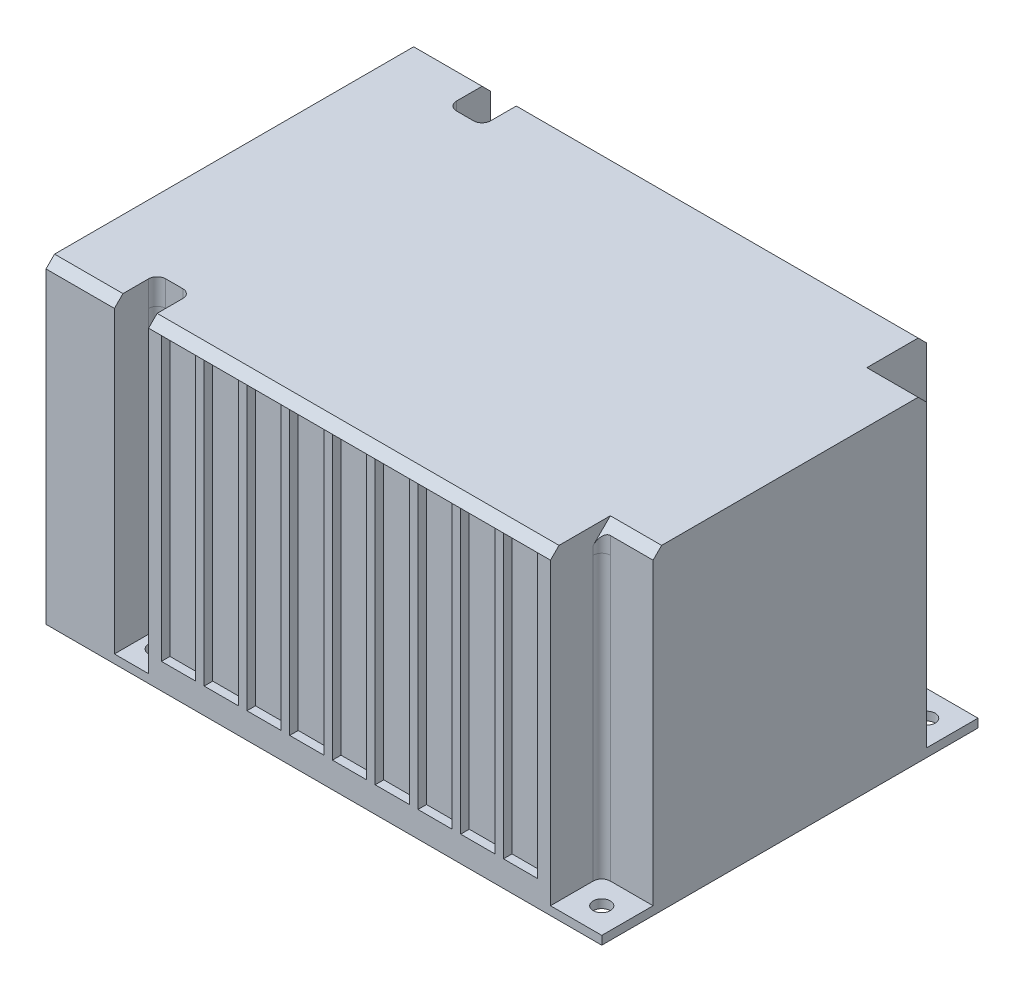
from build123d import *

# Parameters (mm, degrees)
BOSS_EXTRUDE1_DEPTH = 170
SKETCH3_W           = 20
SKETCH3_H           = 25
SKETCH3_R           = 5
SKETCH3_W_2         = 30
SKETCH3_H_2         = 30
BOSS_EXTRUDE2_DEPTH = 5
FILLET1_R           = 5
SKETCH5_R           = 3
CUT_EXTRUDE1_DEPTH  = 3
BOSS_EXTRUDE5_DEPTH = 15
CHAMFER1_SIZE       = 5
FILLET2_R           = 5
SKETCH15_R          = 3
CUT_EXTRUDE2_DEPTH  = 5
SKETCH16_R          = 3
CUT_EXTRUDE3_DEPTH  = 5
SKETCH18_W          = 20
SKETCH18_H          = 165
CUT_EXTRUDE9_DEPTH  = 5
SKETCH21_W          = 20
SKETCH21_H          = 165
CUT_EXTRUDE10_DEPTH = 5


with BuildPart() as part:
    # Sketch1 → Boss-Extrude1 (new body)
    with BuildSketch(Plane(origin=(0, 0, 0), x_dir=(1, 0, 0), z_dir=(0, 1, 0))):
        Polygon((162.5, 80), (162.5, -80), (152.5, -80), (147.5, -80), (132.5, -80), (132.5, -95), (132.5, -100), (132.5, -110), (-102.5, -110), (-102.5, -100), (-102.5, -85), (-112.5, -85), (-122.5, -85), (-122.5, -100), (-122.5, -110), (-162.5, -110), (-162.5, -100), (-162.5, -95), (-132.5, -95), (-132.5, -85), (-132.5, -75), (-93.003639463, -75), (-93.003639463, -100), (122.5, -100), (122.5, -70), (152.5, -70), (152.5, 70), (122.5, 70), (122.5, 100), (-93.003639463, 100), (-93.003639463, 75), (-132.5, 75), (-132.5, 85), (-132.5, 95), (-162.5, 95), (-162.5, 100), (-162.5, 110), (-122.5, 110), (-122.5, 100), (-122.5, 85), (-112.5, 85), (-102.5, 85), (-102.5, 100), (-102.5, 110), (132.5, 110), (132.5, 100), (132.5, 95), (132.5, 80), (147.5, 80), (152.5, 80), align=None)
    extrude(amount=BOSS_EXTRUDE1_DEPTH)

    # Sketch3 → Boss-Extrude2 (add)
    # profile 1 of 4: a face of its own
    with BuildSketch(Plane(origin=(0, 0, 0), x_dir=(1, 0, 0), z_dir=(0, 1, 0))):
        with Locations((-112.5, -97.5)):
            Rectangle(SKETCH3_W, SKETCH3_H)
        with Locations(Location((-112.5, -95, 0), (0, 0, 270))):
            Circle(SKETCH3_R, mode=Mode.SUBTRACT)
    # profile 2 of 4: a face of its own
    with BuildSketch(Plane(origin=(0, 0, 0), x_dir=(1, 0, 0), z_dir=(0, 1, 0))):
        with Locations((147.5, -95)):
            Rectangle(SKETCH3_W_2, SKETCH3_H_2)
        with Locations(Location((147.5, -95, 0), (0, 0, 270))):
            Circle(SKETCH3_R, mode=Mode.SUBTRACT)
    # profile 3 of 4: a face of its own
    with BuildSketch(Plane(origin=(0, 0, 0), x_dir=(1, 0, 0), z_dir=(0, 1, 0))):
        with Locations((-112.5, 97.5)):
            Rectangle(SKETCH3_W, SKETCH3_H)
        with Locations(Location((-112.5, 95, 0), (0, 0, 90))):
            Circle(SKETCH3_R, mode=Mode.SUBTRACT)
    # profile 4 of 4: a face of its own
    with BuildSketch(Plane(origin=(0, 0, 0), x_dir=(1, 0, 0), z_dir=(0, 1, 0))):
        with Locations((147.5, 95)):
            Rectangle(SKETCH3_W_2, SKETCH3_H_2)
        with Locations(Location((147.5, 95, 0), (0, 0, 270))):
            Circle(SKETCH3_R, mode=Mode.SUBTRACT)
    extrude(amount=BOSS_EXTRUDE2_DEPTH)

    # Fillet1
    fillet1_edges = [part.edges().sort_by_distance(p)[0] for p in [
        (-122.5, 87.5, 85),
        (-102.5, 87.5, 85),
        (132.5, 87.5, 80),
        (132.5, 87.5, -80),
        (-102.5, 87.5, -85),
        (-122.5, 87.5, -85),
    ]]
    fillet(fillet1_edges, radius=FILLET1_R)

    # Sketch5 → Cut-Extrude1 (cut)
    with BuildSketch(Plane.ZY.offset(132.5)):
        with Locations((-85, 5)):
            Circle(SKETCH5_R)
        with Locations(Location((85, 5, 0), (0, 0, 180))):
            Circle(SKETCH5_R)
        with Locations((-85, 165)):
            Circle(SKETCH5_R)
        with Locations(Location((85, 165, 0), (0, 0, 180))):
            Circle(SKETCH5_R)
    extrude(amount=-CUT_EXTRUDE1_DEPTH, mode=Mode.SUBTRACT)

    # Sketch10 → Boss-Extrude5 (add)
    with BuildSketch(Plane(origin=(0, 170, 0), x_dir=(1, 0, 0), z_dir=(0, 1, 0))):
        Polygon((-162.5, 95), (-162.5, -95), (-162.5, -100), (-162.5, -110), (-122.5, -110), (-122.5, -100), (-122.5, -85), (-112.5, -85), (-102.5, -85), (-102.5, -100), (-102.5, -110), (132.5, -110), (132.5, -100), (132.5, -95), (132.5, -80), (147.5, -80), (152.5, -80), (162.5, -80), (162.5, 80), (152.5, 80), (147.5, 80), (132.5, 80), (132.5, 95), (132.5, 100), (132.5, 110), (-102.5, 110), (-102.5, 100), (-102.5, 85), (-112.5, 85), (-122.5, 85), (-122.5, 100), (-122.5, 110), (-162.5, 110), (-162.5, 100), align=None)
    extrude(amount=BOSS_EXTRUDE5_DEPTH)

    # Chamfer1
    chamfer1_edges = [part.edges().sort_by_distance(p)[0] for p in [
        (147.5, 185, -80),
        (15, 185, -110),
        (-142.5, 185, -110),
        (-142.5, 185, 110),
        (15, 185, 110),
        (147.5, 185, 80),
    ]]
    chamfer(chamfer1_edges, length=CHAMFER1_SIZE)

    # Fillet2
    fillet2_edges = [part.edges().sort_by_distance(p)[0] for p in [
        (-122.5, 177.5, -85),
        (-102.5, 177.5, -85),
        (132.5, 175, -80),
        (132.5, 175, 80),
        (-102.5, 177.5, 85),
        (-122.5, 177.5, 85),
    ]]
    fillet(fillet2_edges, radius=FILLET2_R)

    # Sketch15 → Cut-Extrude2 (cut)
    with BuildSketch(Plane.XZ):
        with Locations(Location((67.5, -105, 0), (0, 0, 90))):
            Circle(SKETCH15_R)
        with Locations(Location((-32.5, -105, 0), (0, 0, 90))):
            Circle(SKETCH15_R)
        with Locations(Location((157.5, -35, 0), (0, 0, 90))):
            Circle(SKETCH15_R)
        with Locations(Location((157.5, 35, 0), (0, 0, 270))):
            Circle(SKETCH15_R)
        with Locations(Location((67.5, 105, 0), (0, 0, 270))):
            Circle(SKETCH15_R)
        with Locations(Location((-32.5, 105, 0), (0, 0, 270))):
            Circle(SKETCH15_R)
    extrude(amount=-CUT_EXTRUDE2_DEPTH, mode=Mode.SUBTRACT)

    # Sketch16 → Cut-Extrude3 (cut)
    with BuildSketch(Plane.ZY.offset(162.5)):
        with Locations((-102.5, 177.5)):
            Circle(SKETCH16_R)
        with Locations((-102.5, 115.83)):
            Circle(SKETCH16_R)
        with Locations((-102.5, 54.16)):
            Circle(SKETCH16_R)
        with Locations((-34.17, 177.5)):
            Circle(SKETCH16_R)
        with Locations((34.16, 177.5)):
            Circle(SKETCH16_R)
        with Locations((102.49, 177.5)):
            Circle(SKETCH16_R)
        with Locations(Location((102.5, 54.16, 0), (0, 0, 180))):
            Circle(SKETCH16_R)
        with Locations(Location((102.5, 115.83, 0), (0, 0, 180))):
            Circle(SKETCH16_R)
    extrude(amount=-CUT_EXTRUDE3_DEPTH, mode=Mode.SUBTRACT)

    # Sketch18 → Cut-Extrude9 (cut)
    with BuildSketch(Plane.XY.offset(110)):
        with Locations((-35, 97.5)):
            Rectangle(SKETCH18_W, SKETCH18_H)
        with Locations((-10, 97.5)):
            Rectangle(SKETCH18_W, SKETCH18_H)
        with Locations((15, 97.5)):
            Rectangle(SKETCH18_W, SKETCH18_H)
        with Locations((40, 97.5)):
            Rectangle(SKETCH18_W, SKETCH18_H)
        with Locations((65, 97.5)):
            Rectangle(SKETCH18_W, SKETCH18_H)
        with Locations((90, 97.5)):
            Rectangle(SKETCH18_W, SKETCH18_H)
        with Locations((115, 97.5)):
            Rectangle(SKETCH18_W, SKETCH18_H)
        with Locations((-85, 97.5)):
            Rectangle(SKETCH18_W, SKETCH18_H)
        with Locations((-60, 97.5)):
            Rectangle(SKETCH18_W, SKETCH18_H)
    extrude(amount=-CUT_EXTRUDE9_DEPTH, mode=Mode.SUBTRACT)

    # Sketch21 → Cut-Extrude10 (cut)
    with BuildSketch(Plane(origin=(0, 0, -110), x_dir=(-1, 0, 0), z_dir=(0, 0, -1))):
        with Locations((-90, 97.5)):
            Rectangle(SKETCH21_W, SKETCH21_H)
        with Locations((-65, 97.5)):
            Rectangle(SKETCH21_W, SKETCH21_H)
        with Locations((-40, 97.5)):
            Rectangle(SKETCH21_W, SKETCH21_H)
        with Locations((-15, 97.5)):
            Rectangle(SKETCH21_W, SKETCH21_H)
        with Locations((10, 97.5)):
            Rectangle(SKETCH21_W, SKETCH21_H)
        with Locations((35, 97.5)):
            Rectangle(SKETCH21_W, SKETCH21_H)
        with Locations((60, 97.5)):
            Rectangle(SKETCH21_W, SKETCH21_H)
        with Locations((85, 97.5)):
            Rectangle(SKETCH21_W, SKETCH21_H)
        with Locations((-115, 97.5)):
            Rectangle(SKETCH21_W, SKETCH21_H)
    extrude(amount=-CUT_EXTRUDE10_DEPTH, mode=Mode.SUBTRACT)


solid = part.part
